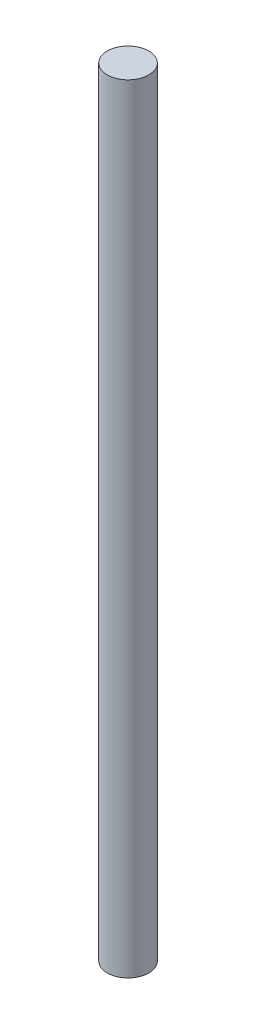
from build123d import *

# Parameters (mm, degrees)
SKETCH1_R           = 4
BOSS_EXTRUDE1_DEPTH = 150


with BuildPart() as part:
    # Sketch1 → Boss-Extrude1 (new body)
    with BuildSketch(Plane(origin=(0, 0, 0), x_dir=(1, 0, 0), z_dir=(0, 1, 0))):
        with Locations(Location((0, 0, 0), (0, 0, 90))):
            Circle(SKETCH1_R)
    extrude(amount=BOSS_EXTRUDE1_DEPTH)


solid = part.part
